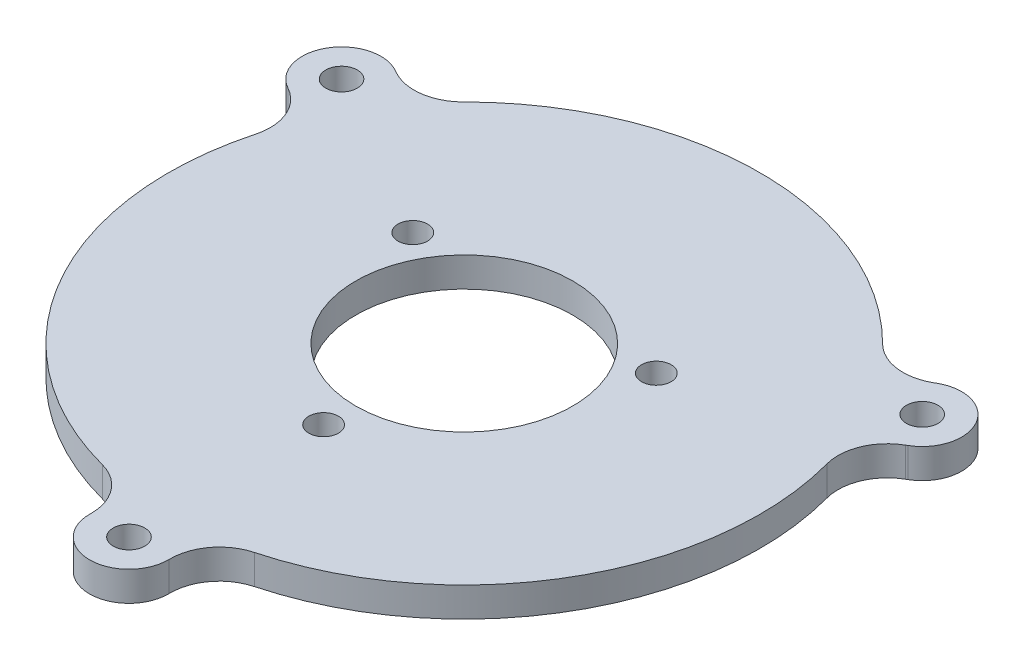
from build123d import *

# Parameters (mm, degrees)
SKETCH1_R           = 1.6
SKETCH1_R_2         = 11
SKETCH1_R_3         = 1.5
BOSS_EXTRUDE1_DEPTH = 3


with BuildPart() as part:
    # Sketch1 → Boss-Extrude1 (new body)
    with BuildSketch(Plane(origin=(0, 0, 0), x_dir=(1, 0, 0), z_dir=(0, 1, 0))):
        with BuildLine():
            Line((31.291637032, 13.44743291), (31.444863729, 13.535898385))
            ThreePointArc((31.444863729, 13.535898385), (32.908965344, 19), (27.444863729, 20.464101615))
            Line((27.444863729, 20.464101615), (27.291637032, 20.37563614))
            ThreePointArc((27.291637032, 20.37563614), (24.134706135, 19.749106847), (21.249974599, 21.176368422))
            ThreePointArc((21.249974599, 21.176368422), (0, 30), (-21.249974599, 21.176368422))
            ThreePointArc((-21.249974599, 21.176368422), (-24.134706135, 19.749106847), (-27.291637032, 20.37563614))
            Line((-27.291637032, 20.37563614), (-27.444863729, 20.464101615))
            ThreePointArc((-27.444863729, 20.464101615), (-32.92840763, 18.965940459), (-31.376555663, 13.49734868))
            ThreePointArc((-31.376555663, 13.49734868), (-29.189007561, 11.073540998), (-28.963860498, 7.816315311))
            ThreePointArc((-28.963860498, 7.816315311), (-25.980762114, -15), (-7.712802626, -28.991596639))
            ThreePointArc((-7.712802626, -28.991596639), (-5.004535966, -30.815192558), (-3.999230991, -33.921568627))
            ThreePointArc((-3.999230991, -33.921568627), (0, -38), (3.999230991, -33.921568627))
            ThreePointArc((3.999230991, -33.921568627), (5.004535966, -30.815192558), (7.712802626, -28.991596639))
            ThreePointArc((7.712802626, -28.991596639), (25.980378434, -15.000664533), (28.964260313, 7.814833621))
            ThreePointArc((28.964260313, 7.814833621), (29.170581299, 11.026715202), (31.291637032, 13.44743291))
        make_face()
        with Locations(Location((-29.444863729, 17, 0), (0, 0, 270))):
            Circle(SKETCH1_R, mode=Mode.SUBTRACT)
        with Locations(Location((29.444863729, 17, 0), (0, 0, 270))):
            Circle(SKETCH1_R, mode=Mode.SUBTRACT)
        with Locations(Location((0, -34, 0), (0, 0, 270))):
            Circle(SKETCH1_R, mode=Mode.SUBTRACT)
        with Locations(Location((0, 0, 0), (0, 0, 270))):
            Circle(SKETCH1_R_2, mode=Mode.SUBTRACT)
        with Locations(Location((-12.35, 7.130275824, 0), (0, 0, 270))):
            Circle(SKETCH1_R_3, mode=Mode.SUBTRACT)
        with Locations(Location((12.35, 7.130275824, 0), (0, 0, 270))):
            Circle(SKETCH1_R_3, mode=Mode.SUBTRACT)
        with Locations(Location((0, -14.260551649, 0), (0, 0, 270))):
            Circle(SKETCH1_R_3, mode=Mode.SUBTRACT)
    extrude(amount=BOSS_EXTRUDE1_DEPTH)


solid = part.part
